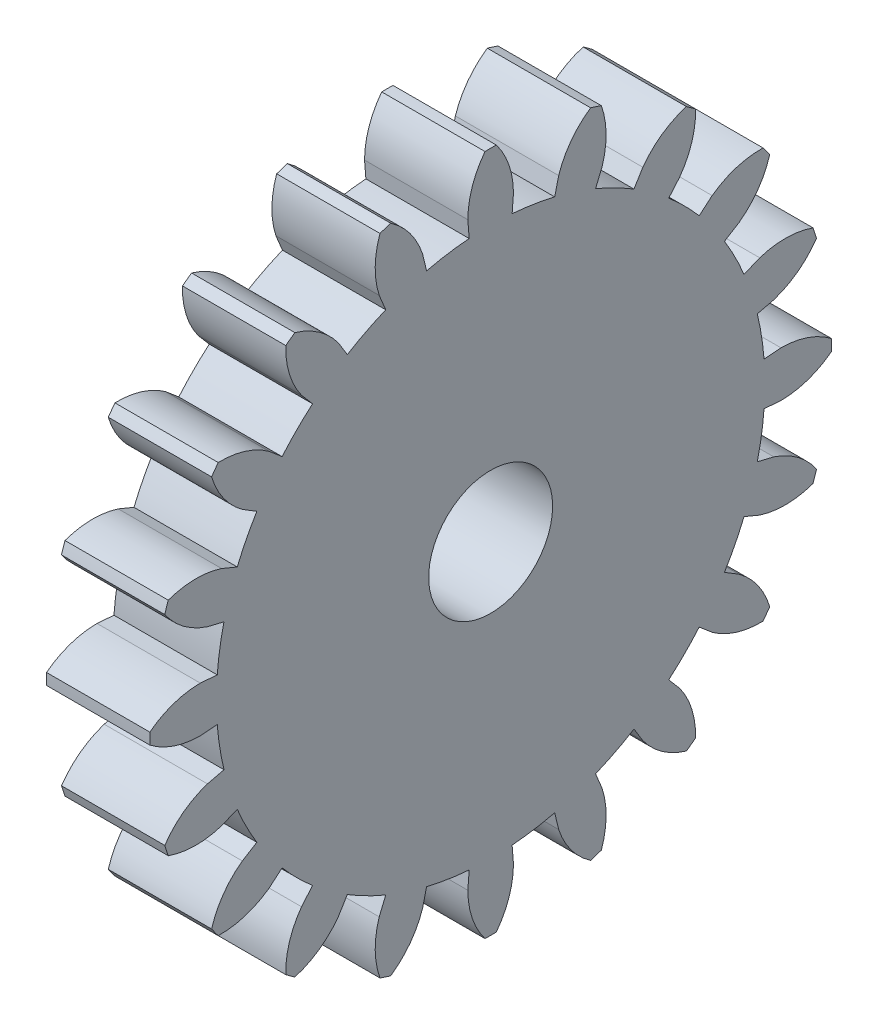
from build123d import *

# Parameters (mm, degrees)
MODEL_R             = 3
BOSS_EXTRUDE3_DEPTH = 5


with BuildPart() as part:
    # Model → Boss-Extrude3 (new body)
    with BuildSketch(Plane.YZ):
        with BuildLine():
            Line((13.23422421, -1.039678776), (14.054007268, -1.104122279))
            ThreePointArc((14.054007268, -1.104122279), (15.344427311, -0.890154011), (16.497633121, -0.272835077))
            ThreePointArc((16.497633121, -0.272835077), (16.499889045, 0), (16.497633121, 0.272835077))
            ThreePointArc((16.497633121, 0.272835077), (15.34442594, 0.890147785), (14.054007268, 1.104113746))
            Line((14.054007268, 1.104113746), (13.23422421, 1.039678776))
            ThreePointArc((13.23422421, 1.039678776), (13.111569145, 2.076626337), (12.907793057, 3.100725851))
            Line((12.907793057, 3.100725851), (13.707329207, 3.292922702))
            ThreePointArc((13.707329207, 3.292922702), (14.868425654, 3.895152548), (15.774406226, 4.838563885))
            ThreePointArc((15.774406226, 4.838563885), (15.692222832, 5.098794143), (15.60574669, 5.357629562))
            ThreePointArc((15.60574669, 5.357629562), (14.318274111, 5.588337046), (13.024951323, 5.393073752))
            Line((13.024951323, 5.393073752), (12.265239884, 5.078337619))
            ThreePointArc((12.265239884, 5.078337619), (11.828111536, 6.02672381), (11.317788592, 6.937815491))
            Line((11.317788592, 6.937815491), (12.018874896, 7.367617174))
            ThreePointArc((12.018874896, 7.367617174), (12.937059572, 8.29919163), (13.507168648, 9.476421305))
            ThreePointArc((13.507168648, 9.476421305), (13.348651089, 9.698493941), (13.186482736, 9.917914762))
            ThreePointArc((13.186482736, 9.917914762), (11.890651127, 9.739508353), (10.72089422, 9.154121999))
            Line((10.72089422, 9.154121999), (10.095695669, 8.619892769))
            ThreePointArc((10.095695669, 8.619892769), (9.386972883, 9.386712017), (8.620173331, 10.095456114))
            Line((8.620173331, 10.095456114), (9.153880493, 10.721137246))
            ThreePointArc((9.153880493, 10.721137246), (9.739259724, 11.890873647), (9.917672889, 13.186682597))
            ThreePointArc((9.917672889, 13.186682597), (9.698234401, 13.348871345), (9.476143545, 13.507408695))
            ThreePointArc((9.476143545, 13.507408695), (8.298924763, 12.937292239), (7.367360076, 12.019107034))
            Line((7.367360076, 12.019107034), (6.937941159, 11.317711556))
            ThreePointArc((6.937941159, 11.317711556), (6.026818359, 11.828063361), (5.078397518, 12.265215084))
            Line((5.078397518, 12.265215084), (5.393131966, 13.025188132))
            ThreePointArc((5.393131966, 13.025188132), (5.588395055, 14.318515258), (5.357684148, 15.605991551))
            ThreePointArc((5.357684148, 15.605991551), (5.098848094, 15.692468837), (4.838617177, 15.774653351))
            ThreePointArc((4.838617177, 15.774653351), (3.895206219, 14.868670943), (3.292977313, 13.707572882))
            Line((3.292977313, 13.707572882), (3.100760275, 12.907784787))
            ThreePointArc((3.100760275, 12.907784787), (2.076645901, 13.111566047), (1.039682977, 13.23422388))
            Line((1.039682977, 13.23422388), (1.104104268, 14.054249317))
            ThreePointArc((1.104104268, 14.054249317), (0.890123262, 15.344688358), (0.272780986, 16.497905294))
            ThreePointArc((0.272780986, 16.497905294), (0, 16.500160321), (-0.272780986, 16.497905294))
            ThreePointArc((-0.272780986, 16.497905294), (-0.890123262, 15.344688358), (-1.104104268, 14.054249317))
            Line((-1.104104268, 14.054249317), (-1.039682977, 13.23422388))
            ThreePointArc((-1.039682977, 13.23422388), (-2.076645901, 13.111566047), (-3.100760275, 12.907784787))
            Line((-3.100760275, 12.907784787), (-3.292901189, 13.707572882))
            ThreePointArc((-3.292901189, 13.707572882), (-3.895130728, 14.8686712), (-4.838542654, 15.774653351))
            ThreePointArc((-4.838542654, 15.774653351), (-5.09877719, 15.692468897), (-5.357616845, 15.605991551))
            ThreePointArc((-5.357616845, 15.605991551), (-5.588327412, 14.318515249), (-5.393064608, 13.025188132))
            Line((-5.393064608, 13.025188132), (-5.078397518, 12.265215084))
            ThreePointArc((-5.078397518, 12.265215084), (-6.026818359, 11.828063361), (-6.937941159, 11.317711556))
            Line((-6.937941159, 11.317711556), (-7.367917741, 12.019107034))
            ThreePointArc((-7.367917741, 12.019107034), (-8.299522933, 12.93730687), (-9.476792265, 13.507408695))
            ThreePointArc((-9.476792265, 13.507408695), (-9.69882033, 13.348870312), (-9.918196776, 13.186682597))
            ThreePointArc((-9.918196776, 13.186682597), (-9.739783579, 11.890873626), (-9.154404251, 10.721137246))
            Line((-9.154404251, 10.721137246), (-8.620173331, 10.095456114))
            ThreePointArc((-8.620173331, 10.095456114), (-9.386972883, 9.386712017), (-10.095695669, 8.619892769))
            Line((-10.095695669, 8.619892769), (-10.721421894, 9.154121999))
            ThreePointArc((-10.721421894, 9.154121999), (-11.891119242, 9.739488239), (-13.18688523, 9.917914762))
            ThreePointArc((-13.18688523, 9.917914762), (-13.349106741, 9.698494383), (-13.507677449, 9.476421305))
            ThreePointArc((-13.507677449, 9.476421305), (-12.937567793, 8.29919139), (-12.019382207, 7.367617174))
            Line((-12.019382207, 7.367617174), (-11.317788592, 6.937815491))
            ThreePointArc((-11.317788592, 6.937815491), (-11.828111536, 6.02672381), (-12.265239884, 5.078337619))
            Line((-12.265239884, 5.078337619), (-13.025469237, 5.393073752))
            ThreePointArc((-13.025469237, 5.393073752), (-14.318795833, 5.588338267), (-15.606272205, 5.357629562))
            ThreePointArc((-15.606272205, 5.357629562), (-15.692748124, 5.098794139), (-15.774931305, 4.838563885))
            ThreePointArc((-15.774931305, 4.838563885), (-14.868950755, 3.895152556), (-13.707854335, 3.292922702))
            Line((-13.707854335, 3.292922702), (-12.907793057, 3.100725851))
            ThreePointArc((-12.907793057, 3.100725851), (-13.111569145, 2.076626337), (-13.23422421, 1.039678776))
            Line((-13.23422421, 1.039678776), (-14.05453238, 1.104113746))
            ThreePointArc((-14.05453238, 1.104113746), (-15.344937836, 0.890143752), (-16.498133136, 0.272835077))
            ThreePointArc((-16.498133136, 0.272835077), (-16.500389058, 0), (-16.498133136, -0.272835077))
            ThreePointArc((-16.498133136, -0.272835077), (-15.344939207, -0.890149979), (-14.05453238, -1.104122279))
            Line((-14.05453238, -1.104122279), (-13.23422421, -1.039678776))
            ThreePointArc((-13.23422421, -1.039678776), (-13.111569145, -2.076626337), (-12.907793057, -3.100725851))
            Line((-12.907793057, -3.100725851), (-13.707854335, -3.292963653))
            ThreePointArc((-13.707854335, -3.292963653), (-14.868950761, -3.895193523), (-15.774931305, -4.838604875))
            ThreePointArc((-15.774931305, -4.838604875), (-15.692748091, -5.098833138), (-15.606272205, -5.35766658))
            ThreePointArc((-15.606272205, -5.35766658), (-14.318795843, -5.588375668), (-13.025469237, -5.393110833))
            Line((-13.025469237, -5.393110833), (-12.265239884, -5.078337619))
            ThreePointArc((-12.265239884, -5.078337619), (-11.828111536, -6.02672381), (-11.317788592, -6.937815491))
            Line((-11.317788592, -6.937815491), (-12.019382207, -7.367660494))
            ThreePointArc((-12.019382207, -7.367660494), (-12.937567956, -8.299235159), (-13.507677449, -9.476465634))
            ThreePointArc((-13.507677449, -9.476465634), (-13.34910671, -9.698536821), (-13.18688523, -9.917955332))
            ThreePointArc((-13.18688523, -9.917955332), (-11.891119181, -9.739528715), (-10.721421894, -9.154162191))
            Line((-10.721421894, -9.154162191), (-10.095695669, -8.619892769))
            ThreePointArc((-10.095695669, -8.619892769), (-9.386972883, -9.386712017), (-8.620173331, -10.095456114))
            Line((-8.620173331, -10.095456114), (-9.154404251, -10.721178465))
            ThreePointArc((-9.154404251, -10.721178465), (-9.739783866, -11.890915694), (-9.918196776, -13.186725599))
            ThreePointArc((-9.918196776, -13.186725599), (-9.698820328, -13.348913221), (-9.476792265, -13.507451513))
            ThreePointArc((-9.476792265, -13.507451513), (-8.299522952, -12.937349732), (-7.367917741, -12.019149967))
            Line((-7.367917741, -12.019149967), (-6.937941159, -11.317711556))
            ThreePointArc((-6.937941159, -11.317711556), (-6.026818359, -11.828063361), (-5.078397518, -12.265215084))
            Line((-5.078397518, -12.265215084), (-5.393064608, -13.025228542))
            ThreePointArc((-5.393064608, -13.025228542), (-5.588327412, -14.31855566), (-5.357616845, -15.606031962))
            ThreePointArc((-5.357616845, -15.606031962), (-5.098777189, -15.692509269), (-4.838542654, -15.774693688))
            ThreePointArc((-4.838542654, -15.774693688), (-3.895130728, -14.868711537), (-3.292901189, -13.707613219))
            Line((-3.292901189, -13.707613219), (-3.100760275, -12.907784787))
            ThreePointArc((-3.100760275, -12.907784787), (-2.076645901, -13.111566047), (-1.039682977, -13.23422388))
            Line((-1.039682977, -13.23422388), (-1.104104268, -14.054290311))
            ThreePointArc((-1.104104268, -14.054290311), (-0.890123262, -15.344729352), (-0.272780986, -16.497946289))
            ThreePointArc((-0.272780986, -16.497946289), (0, -16.500201314), (0.272780986, -16.497946289))
            ThreePointArc((0.272780986, -16.497946289), (0.890123262, -15.344729352), (1.104104268, -14.054290311))
            Line((1.104104268, -14.054290311), (1.039682977, -13.23422388))
            ThreePointArc((1.039682977, -13.23422388), (2.076645901, -13.111566047), (3.100760275, -12.907784787))
            Line((3.100760275, -12.907784787), (3.292977313, -13.707613219))
            ThreePointArc((3.292977313, -13.707613219), (3.895206219, -14.868711279), (4.838617177, -15.774693688))
            ThreePointArc((4.838617177, -15.774693688), (5.098848093, -15.69250921), (5.357684148, -15.606031962))
            ThreePointArc((5.357684148, -15.606031962), (5.588395055, -14.318555669), (5.393131966, -13.025228542))
            Line((5.393131966, -13.025228542), (5.078397518, -12.265215084))
            ThreePointArc((5.078397518, -12.265215084), (6.026818359, -11.828063361), (6.937941159, -11.317711556))
            Line((6.937941159, -11.317711556), (7.367360076, -12.019149967))
            ThreePointArc((7.367360076, -12.019149967), (8.298924781, -12.937335102), (9.476143545, -13.507451513))
            ThreePointArc((9.476143545, -13.507451513), (9.698234399, -13.348914253), (9.917672889, -13.186725599))
            ThreePointArc((9.917672889, -13.186725599), (9.73926001, -11.890915714), (9.153880493, -10.721178465))
            Line((9.153880493, -10.721178465), (8.620173331, -10.095456114))
            ThreePointArc((8.620173331, -10.095456114), (9.386972883, -9.386712017), (10.095695669, -8.619892769))
            Line((10.095695669, -8.619892769), (10.72089422, -9.154162191))
            ThreePointArc((10.72089422, -9.154162191), (11.890651066, -9.739548829), (13.186482736, -9.917955332))
            ThreePointArc((13.186482736, -9.917955332), (13.348651058, -9.698536379), (13.507168648, -9.476465634))
            ThreePointArc((13.507168648, -9.476465634), (12.937059735, -8.299235399), (12.018874896, -7.367660494))
            Line((12.018874896, -7.367660494), (11.317788592, -6.937815491))
            ThreePointArc((11.317788592, -6.937815491), (11.828111536, -6.02672381), (12.265239884, -5.078337619))
            Line((12.265239884, -5.078337619), (13.024951323, -5.393110833))
            ThreePointArc((13.024951323, -5.393110833), (14.318274121, -5.588374447), (15.60574669, -5.35766658))
            ThreePointArc((15.60574669, -5.35766658), (15.692222799, -5.098833142), (15.774406226, -4.838604875))
            ThreePointArc((15.774406226, -4.838604875), (14.86842566, -3.895193515), (13.707329207, -3.292963653))
            Line((13.707329207, -3.292963653), (12.907793057, -3.100725851))
            ThreePointArc((12.907793057, -3.100725851), (13.111569145, -2.076626337), (13.23422421, -1.039678776))
        make_face()
        with Locations(Location((0, 0, 0), (0, 0, 270))):
            Circle(MODEL_R, mode=Mode.SUBTRACT)
    extrude(amount=BOSS_EXTRUDE3_DEPTH)


solid = part.part
